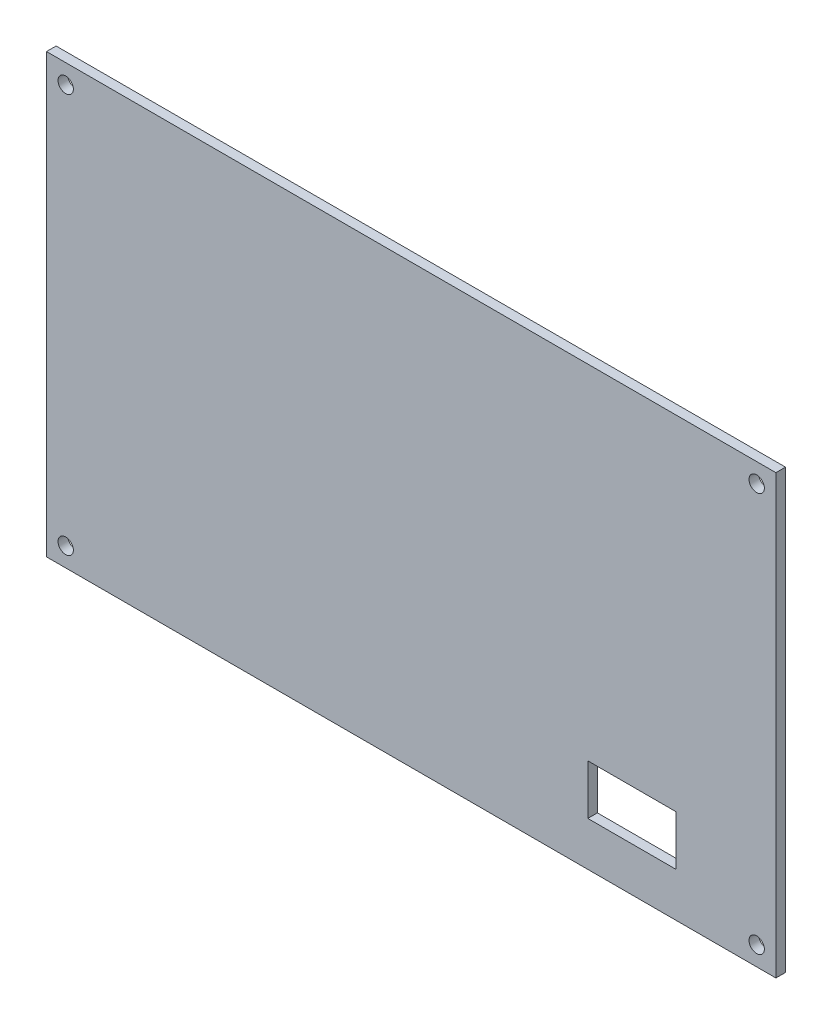
from build123d import *

# Parameters (mm, degrees)
SKETCH1_W           = 190
SKETCH1_H           = 114
BOSS_EXTRUDE1_DEPTH = 2.5
SKETCH3_R           = 2
CUT_EXTRUDE2_DEPTH  = 10
SKETCH4_W           = 23
SKETCH4_H           = 13
CUT_EXTRUDE3_DEPTH  = 21


with BuildPart() as part:
    # Sketch1 → Boss-Extrude1 (new body)
    with BuildSketch(Plane.XY):
        Rectangle(SKETCH1_W, SKETCH1_H)
    extrude(amount=BOSS_EXTRUDE1_DEPTH)

    # Sketch3 → Cut-Extrude2 (cut)
    with BuildSketch(Plane.XY.offset(2.5)):
        with Locations((-90, 52)):
            Circle(SKETCH3_R)
        with Locations((90, 52)):
            Circle(SKETCH3_R)
        with Locations((90, -52)):
            Circle(SKETCH3_R)
        with Locations((-90, -52)):
            Circle(SKETCH3_R)
    extrude(amount=-CUT_EXTRUDE2_DEPTH, mode=Mode.SUBTRACT)

    # Sketch4 → Cut-Extrude3 (cut)
    with BuildSketch(Plane.XY.offset(2.5)):
        with Locations((57.5, -39)):
            Rectangle(SKETCH4_W, SKETCH4_H)
    extrude(amount=-CUT_EXTRUDE3_DEPTH, mode=Mode.SUBTRACT)


solid = part.part
